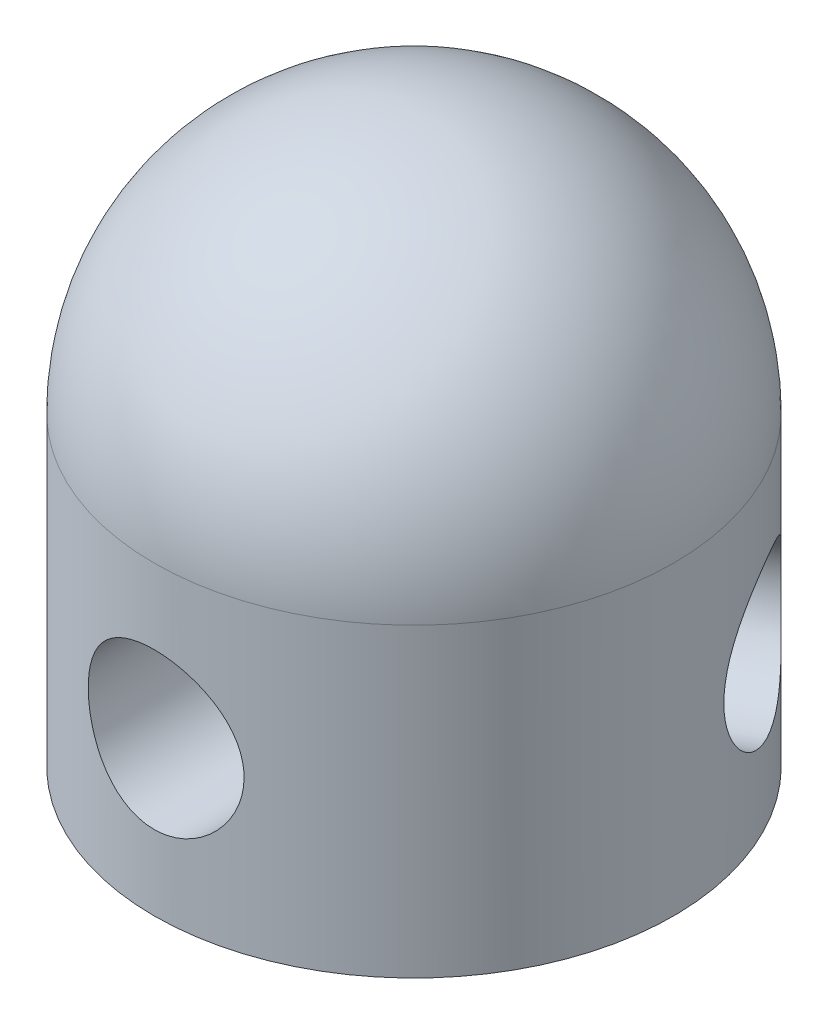
from build123d import *

# Parameters (mm, degrees)
CIRKEL_R                   = 17
CILINDER_DEPTH             = 20
CIRKEL_GAT_R               = 5.1
OPENING_DEPTH              = 10
GATEN_PATROON_COUNT        = 3
CIRKEL1_R                  = 13.5
OPENING_OPZET_DEPTH        = 3
CIRKEL2_R                  = 2
GAT_VERLOOPSTUK_DEPTH      = 8
CIRKEL3_R                  = 3
GAT_VERLOOPSTUK_RAND_DEPTH = 2


with BuildPart() as part:
    # cirkel → cilinder (new body)
    with BuildSketch(Plane(origin=(0, 0, 0), x_dir=(1, 0, 0), z_dir=(0, 1, 0))):
        with Locations(Location((0, 0, 0), (0, 0, 270))):
            Circle(CIRKEL_R)
    extrude(amount=CILINDER_DEPTH)

    # boog → bol (revolve)
    with BuildSketch(Plane.XY):
        with BuildLine():
            Line((0, 20), (0, 37))
            ThreePointArc((0, 37), (-12.02081528, 32.02081528), (-17, 20))
            Line((-17, 20), (0, 20))
        make_face()
    revolve(axis=Axis((0, 20, 0), (0, 1, 0)))

    # cirkel_gat → opening (cut)
    with BuildSketch(Plane.XY.offset(17)):
        with Locations((0, 10)):
            Circle(CIRKEL_GAT_R)
    opening = extrude(amount=-OPENING_DEPTH, mode=Mode.SUBTRACT)

    # gaten_patroon: opening ×3 about axis
    gaten_patroon_axis = Axis((0, 0, 0), (0, 1, 0))
    for i in range(1, GATEN_PATROON_COUNT):
        add(opening.rotate(gaten_patroon_axis, i * 360 / GATEN_PATROON_COUNT), mode=Mode.SUBTRACT)

    # cirkel1 → opening_opzet (cut)
    with BuildSketch(Plane(origin=(0, 0, 0), x_dir=(-1, 0, 0), z_dir=(0, -1, 0))):
        with Locations(Location((0, 0, 0), (0, 0, 90))):
            Circle(CIRKEL1_R)
    extrude(amount=-OPENING_OPZET_DEPTH, mode=Mode.SUBTRACT)

    # cirkel2 → gat_verloopstuk (cut)
    with BuildSketch(Plane(origin=(0, 3, 0), x_dir=(-1, 0, 0), z_dir=(0, -1, 0))):
        with Locations(Location((0, 0, 0), (0, 0, 90))):
            Circle(CIRKEL2_R)
    extrude(amount=-GAT_VERLOOPSTUK_DEPTH, mode=Mode.SUBTRACT)

    # cirkel3 → gat_verloopstuk_rand (cut)
    with BuildSketch(Plane.XZ.offset(-3)):
        with Locations(Location((0, 0, 0), (0, 0, 270))):
            Circle(CIRKEL3_R)
    extrude(amount=-GAT_VERLOOPSTUK_RAND_DEPTH, mode=Mode.SUBTRACT)


solid = part.part
